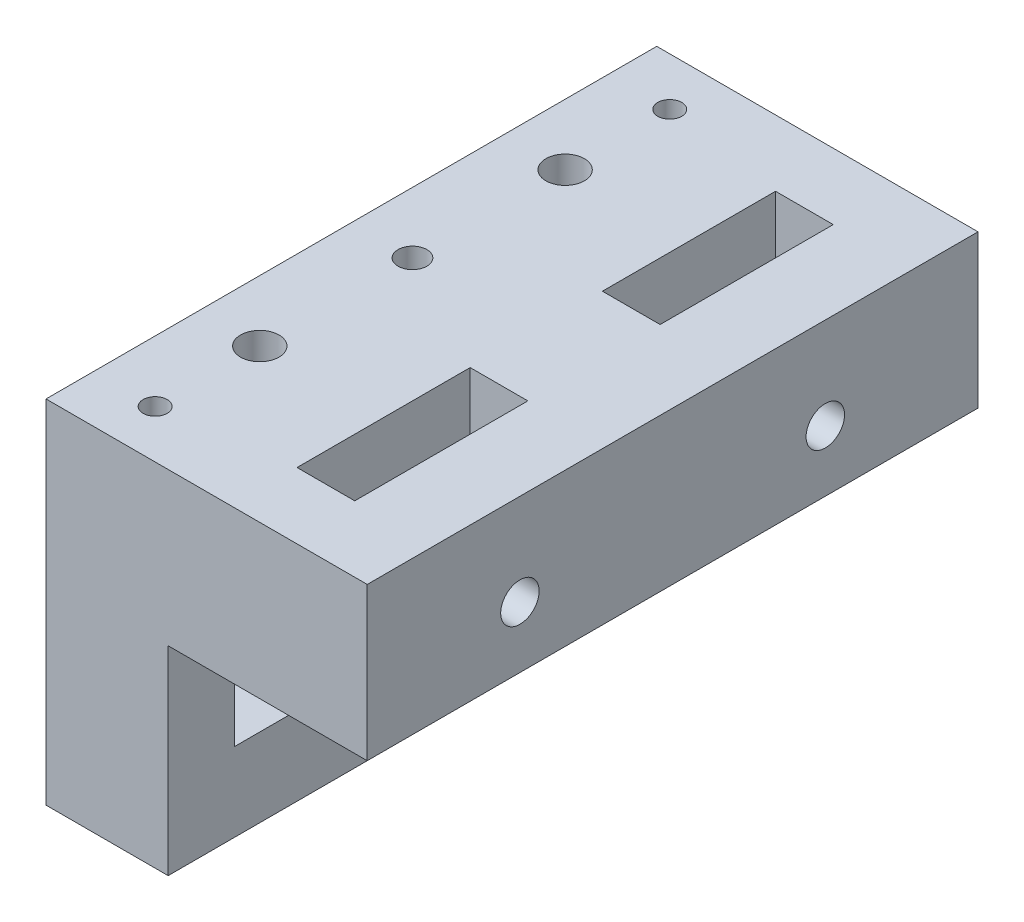
from build123d import *

# Parameters (mm, degrees)
BOSS_EXTRUDE1_DEPTH = 12.7
SKETCH2_W           = 12.7
SKETCH2_H           = 63.5
BOSS_EXTRUDE2_DEPTH = 31.75
SKETCH3_W           = 18
SKETCH3_H           = 3
CUT_EXTRUDE1_DEPTH  = 19.05
SKETCH4_R           = 2
CUT_EXTRUDE2_DEPTH  = 59.973007597
SKETCH5_R           = 2
CUT_EXTRUDE3_DEPTH  = 64.181702256
SKETCH6_W           = 63.5
SKETCH6_H           = 12.7
CUT_EXTRUDE4_DEPTH  = 11.05
SKETCH7_W           = 12.7
SKETCH7_H           = 63.5
CUT_EXTRUDE5_DEPTH  = 11.05
BOSS_EXTRUDE3_START = 3.175
SKETCH8_W           = 33.4
SKETCH8_H           = 63.5
SKETCH8_R           = 2
SKETCH8_W_2         = 6
SKETCH8_H_2         = 18
BOSS_EXTRUDE3_DEPTH = 3.175
SKETCH9_R           = 1.25
SKETCH9_R_2         = 1.5
CUT_EXTRUDE6_DEPTH  = 54.289246101


with BuildPart() as part:
    # Sketch1 → Boss-Extrude1 (new body)
    with BuildSketch(Plane(origin=(0, 0, 0), x_dir=(1, 0, 0), z_dir=(0, 1, 0))):
        Polygon((-22.225, 31.75), (-22.225, -31.75), (0, -31.75), (0, -24.875), (-3, -24.875), (-3, -6.875), (0, -6.875), (0, 0), (0, 6.875), (-3, 6.875), (-3, 24.875), (0, 24.875), (0, 31.75), align=None)
        Polygon((0, -24.875), (0, -31.75), (22.225, -31.75), (22.225, 31.75), (0, 31.75), (0, 24.875), (3, 24.875), (3, 6.875), (0, 6.875), (0, 0), (0, -6.875), (3, -6.875), (3, -24.875), align=None)
    extrude(amount=BOSS_EXTRUDE1_DEPTH)

    # Sketch2 → Boss-Extrude2 (add)
    with BuildSketch(Plane.XZ):
        with Locations((-15.875, 0)):
            Rectangle(SKETCH2_W, SKETCH2_H)
    extrude(amount=BOSS_EXTRUDE2_DEPTH)

    # Sketch3 → Cut-Extrude1 (cut)
    with BuildSketch(Plane.ZY.offset(22.225)):
        with Locations((-15.875, -8.025)):
            Rectangle(SKETCH3_W, SKETCH3_H)
        with Locations((-15.875, -11.025)):
            Rectangle(SKETCH3_W, SKETCH3_H)
        with Locations((15.875, -8.025)):
            Rectangle(SKETCH3_W, SKETCH3_H)
        with Locations((15.875, -11.025)):
            Rectangle(SKETCH3_W, SKETCH3_H)
    extrude(amount=-CUT_EXTRUDE1_DEPTH, mode=Mode.SUBTRACT)

    # Sketch4 → Cut-Extrude2 (cut, through all)
    with BuildSketch(Plane(origin=(0, 12.7, 0), x_dir=(1, 0, 0), z_dir=(0, 1, 0))):
        with Locations(Location((-15.875, 15.875, 0), (0, 0, 270))):
            Circle(SKETCH4_R)
        with Locations(Location((-15.875, -15.875, 0), (0, 0, 270))):
            Circle(SKETCH4_R)
    extrude(amount=-CUT_EXTRUDE2_DEPTH, mode=Mode.SUBTRACT)

    # Sketch5 → Cut-Extrude3 (cut, through all)
    with BuildSketch(Plane.ZY.offset(22.225)):
        with Locations((-15.875, 6.35)):
            Circle(SKETCH5_R)
        with Locations((15.875, 6.35)):
            Circle(SKETCH5_R)
    extrude(amount=-CUT_EXTRUDE3_DEPTH, mode=Mode.SUBTRACT)

    # Sketch6 → Cut-Extrude4 (cut)
    with BuildSketch(Plane(origin=(22.225, 0, 0), x_dir=(0, 0, -1), z_dir=(1, 0, 0))):
        with Locations((0, 6.35)):
            Rectangle(SKETCH6_W, SKETCH6_H)
    extrude(amount=-CUT_EXTRUDE4_DEPTH, mode=Mode.SUBTRACT)

    # Sketch7 → Cut-Extrude5 (cut)
    with BuildSketch(Plane.XZ.offset(31.75)):
        with Locations((-15.875, 0)):
            Rectangle(SKETCH7_W, SKETCH7_H)
    extrude(amount=-CUT_EXTRUDE5_DEPTH, mode=Mode.SUBTRACT)

    # Sketch8 → Boss-Extrude3 (add)
    with BuildSketch(Plane(origin=(0, 12.7, 0), x_dir=(1, 0, 0), z_dir=(0, 1, 0)).offset(BOSS_EXTRUDE3_START)):
        with Locations((-5.525, 0)):
            Rectangle(SKETCH8_W, SKETCH8_H)
        with Locations(Location((-15.875, 15.875, 0), (0, 0, 90))):
            Circle(SKETCH8_R, mode=Mode.SUBTRACT)
        with Locations(Location((-15.875, -15.875, 0), (0, 0, 90))):
            Circle(SKETCH8_R, mode=Mode.SUBTRACT)
        with Locations((0, -15.875)):
            Rectangle(SKETCH8_W_2, SKETCH8_H_2, mode=Mode.SUBTRACT)
        with Locations((0, 15.875)):
            Rectangle(SKETCH8_W_2, SKETCH8_H_2, mode=Mode.SUBTRACT)
    extrude(amount=-BOSS_EXTRUDE3_DEPTH)

    # Sketch9 → Cut-Extrude6 (cut, through all)
    with BuildSketch(Plane(origin=(0, 15.875, 0), x_dir=(1, 0, 0), z_dir=(0, 1, 0))):
        with Locations(Location((-15.875, 26.75, 0), (0, 0, 270))):
            Circle(SKETCH9_R)
        with Locations(Location((-15.875, -26.75, 0), (0, 0, 270))):
            Circle(SKETCH9_R)
        with Locations(Location((-15.875, 0, 0), (0, 0, 270))):
            Circle(SKETCH9_R_2)
    extrude(amount=-CUT_EXTRUDE6_DEPTH, mode=Mode.SUBTRACT)


solid = part.part
